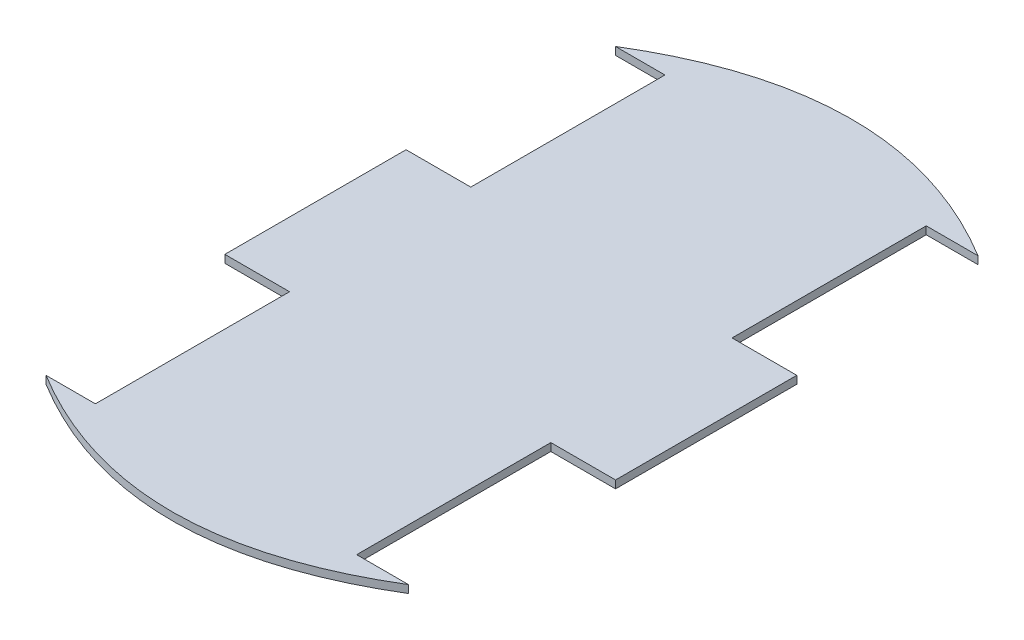
from build123d import *

# Parameters (mm, degrees)
EXTRUDE_1_DEPTH = 3


with BuildPart() as part:
    # 草图1 → 凸台-拉伸1 (new body)
    with BuildSketch(Plane(origin=(0, 0, 0), x_dir=(1, 0, 0), z_dir=(0, 1, 0))):
        with BuildLine():
            Line((-49.987744463, 0), (-49.987744463, 75))
            Line((-49.987744463, 75), (-69.064059337, 75))
            add(Edge.make_bspline(
                [(-69.064059337, 75), (0.777424166, 117.582810978), (70.935940663, 75)],
                knots=[0, 0, 0, 1, 1, 1], degree=2))
            Line((70.935940663, 75), (50.935940663, 75))
            Line((50.935940663, 75), (50.935940663, 0))
            Line((50.935940663, 0), (75.935940663, 0))
            Line((75.935940663, 0), (75.935940663, -70))
            Line((75.935940663, -70), (50.935940663, -70))
            Line((50.935940663, -70), (50.935940663, -145))
            Line((50.935940663, -145), (70.935940663, -145))
            add(Edge.make_bspline(
                [(-69.064059337, -145), (0.777424166, -187.582810978), (70.935940663, -145)],
                knots=[0, 0, 0, 1, 1, 1], degree=2))
            Line((-69.064059337, -145), (-49.987744463, -145))
            Line((-49.987744463, -145), (-49.987744463, -70))
            Line((-49.987744463, -70), (-74.987744463, -70))
            Line((-74.987744463, -70), (-74.987744463, 0))
            Line((-74.987744463, 0), (-49.987744463, 0))
        make_face()
    extrude(amount=EXTRUDE_1_DEPTH)


solid = part.part
